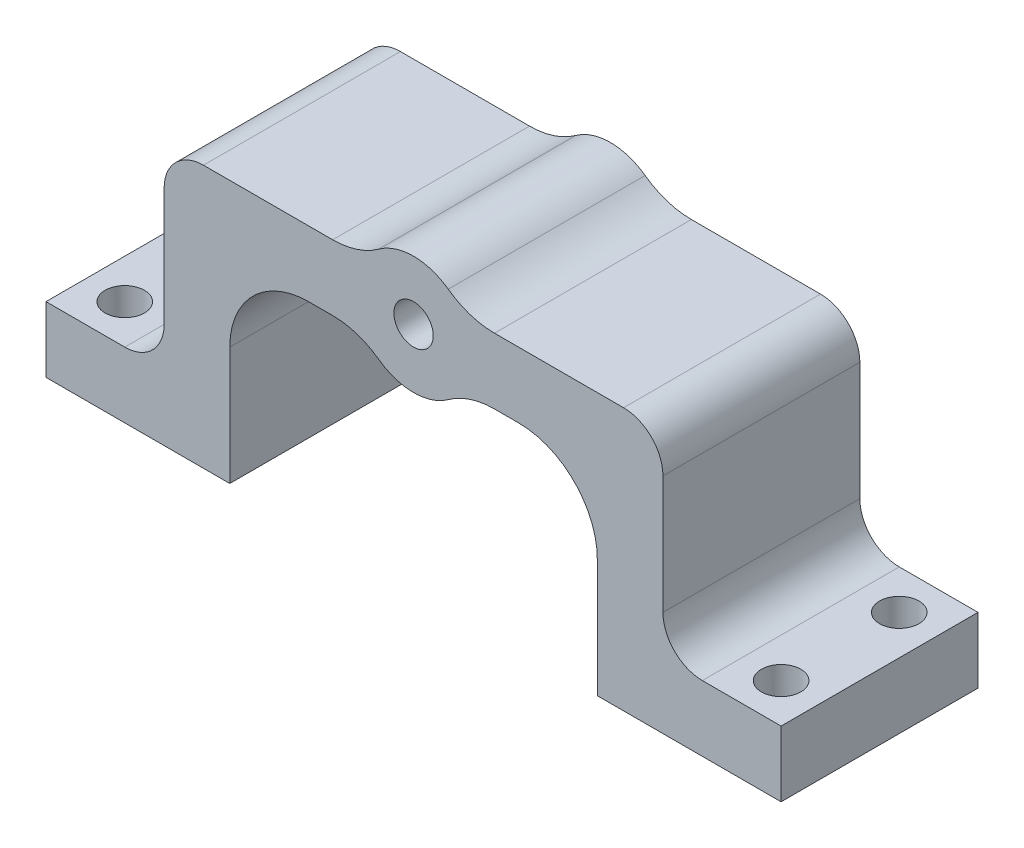
from build123d import *

# Parameters (mm, degrees)
EXTRUDE_1_DEPTH     = 7.5
FILLET_1_R          = 3
FILLET_3_R          = 6
SKETCH_2_R          = 1.5
CUT_EXTRUDE_1_DEPTH = 10
SKETCH_5_R          = 4.5
EXTRUDE_2_DEPTH     = 15
SKETCH_4_R          = 1.5
CUT_EXTRUDE_3_DEPTH = 39.639358173
FILLET_2_R          = 6


with BuildPart() as part:
    # 草图1 → 凸台-拉伸1 (new, symmetric)
    with BuildSketch(Plane.XY):
        Polygon((-28, 5), (-28, 0), (-14, 0), (-14, 15), (0, 15), (0, 20), (-19, 20), (-19, 5), align=None)
        Polygon((0, 20), (0, 15), (14, 15), (14, 0), (28, 0), (28, 5), (19, 5), (19, 20), align=None)
    extrude(amount=EXTRUDE_1_DEPTH, both=True)

    # 圆角1
    fillet_1_edges = [part.edges().sort_by_distance(p)[0] for p in [
        (-19, 5, 0),
        (-19, 20, 0),
        (19, 20, 0),
        (19, 5, 0),
    ]]
    fillet(fillet_1_edges, radius=FILLET_1_R)

    # 圆角3
    fillet_3_edges = [part.edges().sort_by_distance(p)[0] for p in [
        (-14, 15, 0),
        (14, 15, 0),
    ]]
    fillet(fillet_3_edges, radius=FILLET_3_R)

    # 草图2 → 切除-拉伸1 (cut)
    with BuildSketch(Plane(origin=(0, 5, 0), x_dir=(1, 0, 0), z_dir=(0, 1, 0))):
        with Locations(Location((25, -4.5, 0), (0, 0, 180))):
            Circle(SKETCH_2_R)
        with Locations(Location((25, 4.5, 0), (0, 0, 180))):
            Circle(SKETCH_2_R)
    cut_extrude_1 = extrude(amount=-CUT_EXTRUDE_1_DEPTH, mode=Mode.SUBTRACT)

    # 草图5 → 凸台-拉伸2 (add)
    with BuildSketch(Plane.XY.offset(7.5)):
        with Locations((0, 17.5)):
            Circle(SKETCH_5_R)
    extrude(amount=-EXTRUDE_2_DEPTH)

    # 草图4 → 切除-拉伸3 (cut, through all)
    with BuildSketch(Plane.XY.offset(7.5)):
        with Locations((0, 17.5)):
            Circle(SKETCH_4_R)
    extrude(amount=-CUT_EXTRUDE_3_DEPTH, mode=Mode.SUBTRACT)

    # 镜向2: 切除-拉伸1 across plane
    add(cut_extrude_1.mirror(Plane(origin=(0, 0, 0), x_dir=(0, 0, 1), z_dir=(1, 0, 0))), mode=Mode.SUBTRACT)

    # 圆角2
    fillet_2_edges = [part.edges().sort_by_distance(p)[0] for p in [
        (-3.741657387, 15, 0),
        (-3.741657387, 20, 0),
        (3.741657387, 15, 0),
        (3.741657387, 20, 0),
    ]]
    fillet(fillet_2_edges, radius=FILLET_2_R)


solid = part.part
